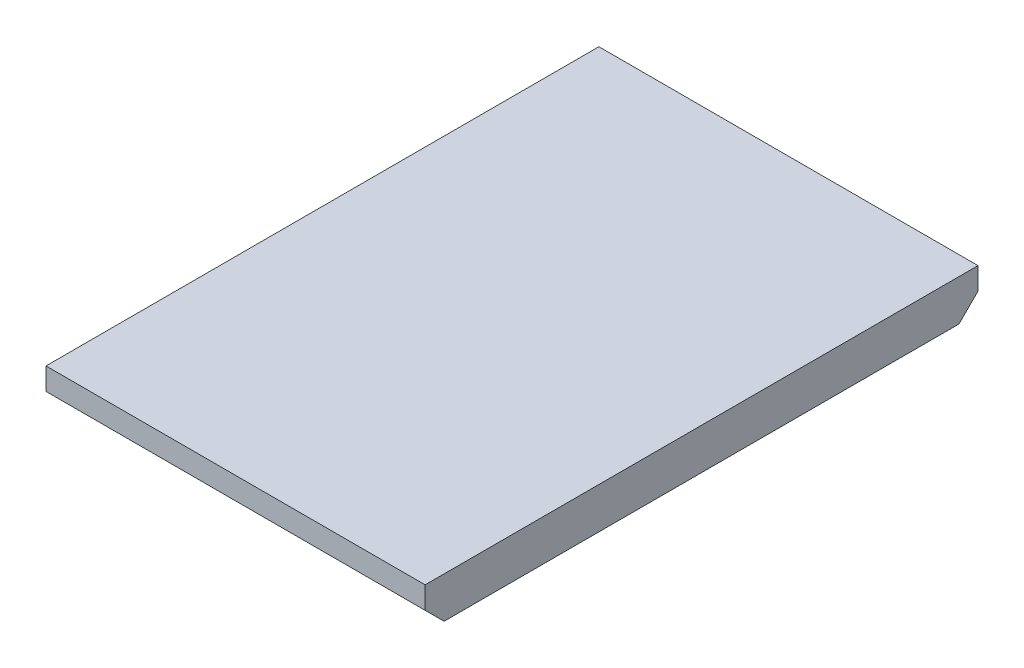
from build123d import *

# Parameters (mm, degrees)
BOSS_EXTRUDE1_DEPTH = 12


with BuildPart() as part:
    # Sketch1 → Boss-Extrude1 (new, symmetric)
    with BuildSketch(Plane(origin=(0, 0, 0), x_dir=(0, 0, -1), z_dir=(1, 0, 0))):
        Polygon((17.5, 0), (-17.5, 0), (-17.5, -1.4), (-16.3, -2.6), (16.3, -2.6), (17.5, -1.4), align=None)
    extrude(amount=BOSS_EXTRUDE1_DEPTH, both=True)


solid = part.part
